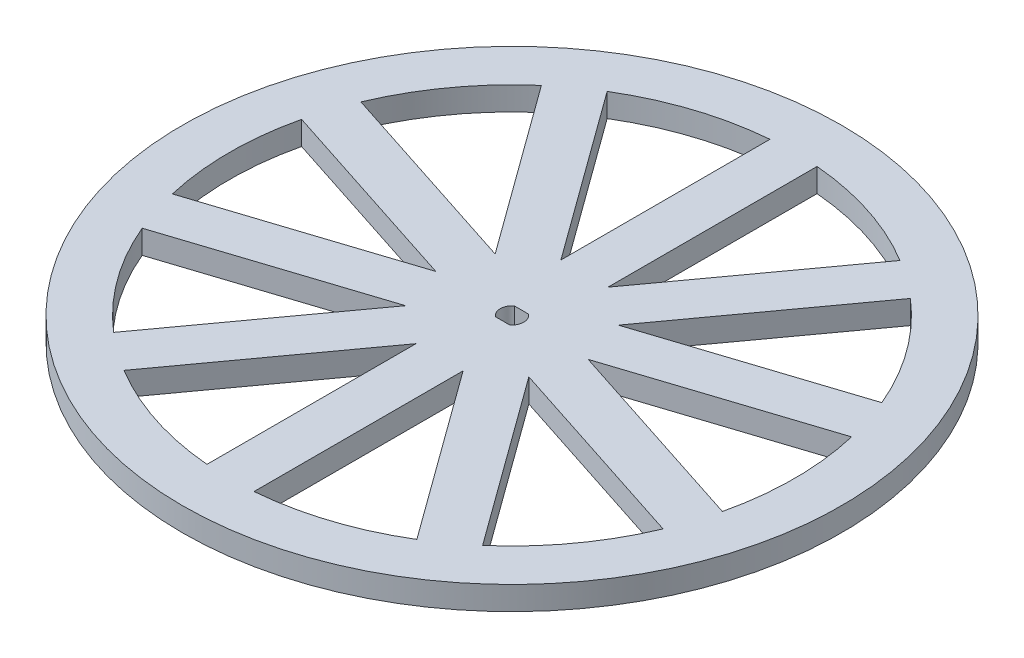
from build123d import *

# Parameters (mm, degrees)
SKETCH1_R           = 70
BOSS_EXTRUDE1_DEPTH = 5


with BuildPart() as part:
    # Sketch1 → Boss-Extrude1 (new body)
    with BuildSketch(Plane(origin=(0, 0, 0), x_dir=(1, 0, 0), z_dir=(0, 1, 0))):
        with Locations(Location((0, 0, 0), (0, 0, 270))):
            Circle(SKETCH1_R)
        with BuildLine():
            Line((55.319824044, 23.231811546), (13.090169944, 9.510565163))
            Line((13.090169944, 9.510565163), (39.189531511, 45.43325456))
            ThreePointArc((39.189531511, 45.43325456), (48.541019662, 35.267115138), (55.319824044, 23.231811546))
        make_face(mode=Mode.SUBTRACT)
        with BuildLine():
            Line((-5, 15.388417687), (-31.099361567, 51.311107083))
            ThreePointArc((-31.099361567, 51.311107083), (-18.541019662, 57.063390978), (-5, 59.791303716))
            Line((-5, 59.791303716), (-5, 15.388417687))
        make_face(mode=Mode.SUBTRACT)
        with BuildLine():
            Line((5, 15.388417686), (31.099361567, 51.311107083))
            ThreePointArc((31.099361567, 51.311107083), (18.541019662, 57.063390978), (5, 59.791303716))
            Line((5, 59.791303716), (5, 15.388417686))
        make_face(mode=Mode.SUBTRACT)
        with BuildLine():
            Line((58.409993988, 13.721246383), (16.180339887, 0))
            Line((16.180339887, 0), (58.409993988, -13.721246382))
            ThreePointArc((58.409993988, -13.721246382), (60, 0), (58.409993988, 13.721246383))
        make_face(mode=Mode.SUBTRACT)
        with BuildLine():
            Line((39.189531511, -45.43325456), (13.090169944, -9.510565163))
            Line((13.090169944, -9.510565163), (55.319824045, -23.231811545))
            ThreePointArc((55.319824045, -23.231811545), (48.541019663, -35.267115137), (39.189531511, -45.43325456))
        make_face(mode=Mode.SUBTRACT)
        with BuildLine():
            Line((31.099361568, -51.311107083), (5, -15.388417685))
            Line((5, -15.388417685), (5, -59.791303716))
            ThreePointArc((5, -59.791303716), (18.541019663, -57.063390978), (31.099361568, -51.311107083))
        make_face(mode=Mode.SUBTRACT)
        with BuildLine():
            Line((-55.319824044, 23.231811546), (-13.090169944, 9.510565163))
            Line((-13.090169944, 9.510565163), (-39.189531511, 45.43325456))
            ThreePointArc((-39.189531511, 45.43325456), (-48.541019662, 35.267115138), (-55.319824044, 23.231811546))
        make_face(mode=Mode.SUBTRACT)
        with BuildLine():
            Line((-58.409993988, 13.721246383), (-16.180339888, 0))
            Line((-16.180339888, 0), (-58.409993988, -13.721246382))
            ThreePointArc((-58.409993988, -13.721246382), (-60, 0), (-58.409993988, 13.721246383))
        make_face(mode=Mode.SUBTRACT)
        with BuildLine():
            Line((-39.189531511, -45.43325456), (-13.090169944, -9.510565163))
            Line((-13.090169944, -9.510565163), (-55.319824045, -23.231811545))
            ThreePointArc((-55.319824045, -23.231811545), (-48.541019663, -35.267115137), (-39.189531511, -45.43325456))
        make_face(mode=Mode.SUBTRACT)
        with BuildLine():
            Line((-31.099361568, -51.311107083), (-5, -15.388417686))
            Line((-5, -15.388417686), (-5, -59.791303715))
            ThreePointArc((-5, -59.791303715), (-18.541019663, -57.063390978), (-31.099361568, -51.311107083))
        make_face(mode=Mode.SUBTRACT)
        with BuildLine():
            Line((-1.5, -2), (1.5, -2))
            ThreePointArc((1.5, -2), (2.5, 0), (1.5, 2))
            Line((1.5, 2), (-1.5, 2))
            ThreePointArc((-1.5, 2), (-2.5, 0), (-1.5, -2))
        make_face(mode=Mode.SUBTRACT)
    extrude(amount=BOSS_EXTRUDE1_DEPTH)


solid = part.part
